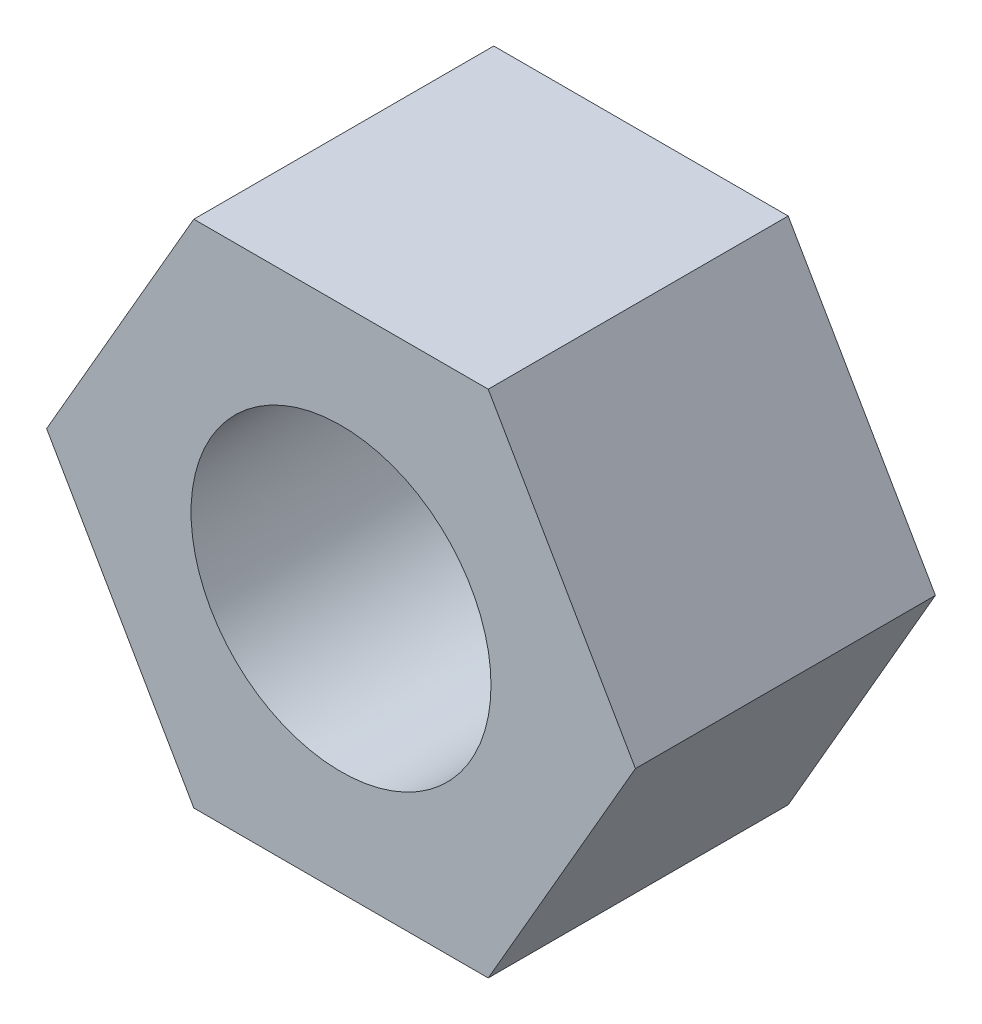
from build123d import *

# Parameters (mm, degrees)
SKETCH1_R           = 2.5
BOSS_EXTRUDE3_DEPTH = 5


with BuildPart() as part:
    # Sketch1 → Boss-Extrude3 (new body)
    with BuildSketch(Plane.XY):
        Polygon((4.907477288, 0), (2.453738644, 4.25), (-2.453738644, 4.25), (-4.907477288, 0), (-2.453738644, -4.25), (2.453738644, -4.25), align=None)
        Circle(SKETCH1_R, mode=Mode.SUBTRACT)
    extrude(amount=-BOSS_EXTRUDE3_DEPTH)


solid = part.part
